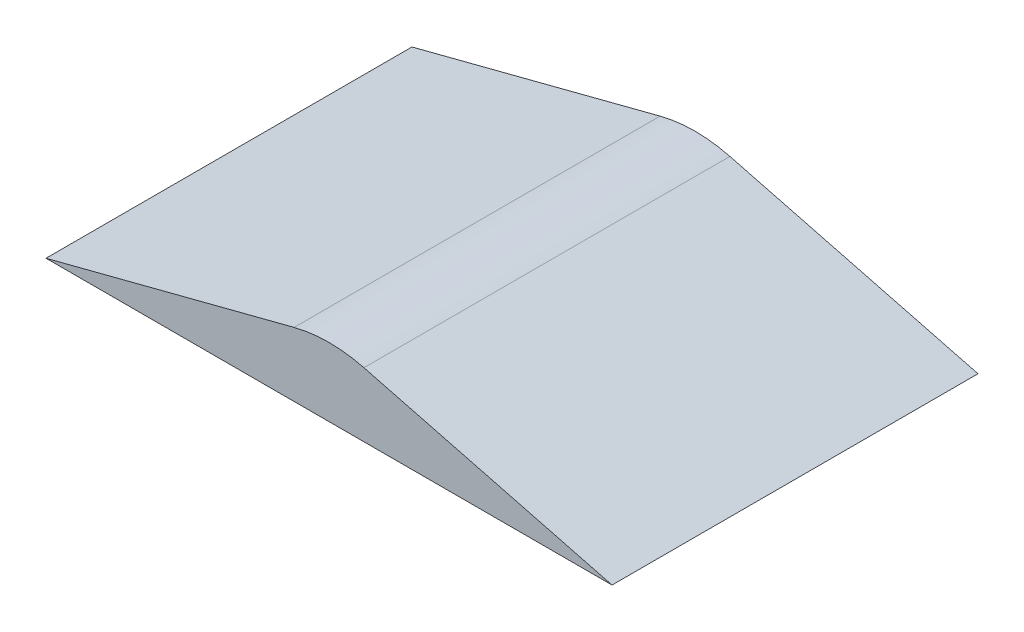
from build123d import *

# Parameters (mm, degrees)
BOSS_EXTRUDE1_DEPTH = 200
SHELL1_T            = -17


with BuildPart() as part:
    # Sketch1 → Boss-Extrude1 (new body)
    with BuildSketch(Plane.XY):
        with BuildLine():
            Line((-151.256685576, -7.691916928), (-15.667118089, 27.373929479))
            ThreePointArc((-15.667118089, 27.373929479), (3.41183822, 29.801079282), (22.490794529, 27.373929479))
            Line((22.490794529, 27.373929479), (158.080362016, -7.691916928))
            Line((158.080362016, -7.691916928), (-151.256685576, -7.691916928))
        make_face()
    extrude(amount=BOSS_EXTRUDE1_DEPTH)

    # Shell1
    shell1_openings = [part.faces().sort_by_distance(p)[0] for p in [
        (3.41183822, -7.691916928, 100),
    ]]
    offset(amount=SHELL1_T, openings=shell1_openings, kind=Kind.INTERSECTION)


solid = part.part
